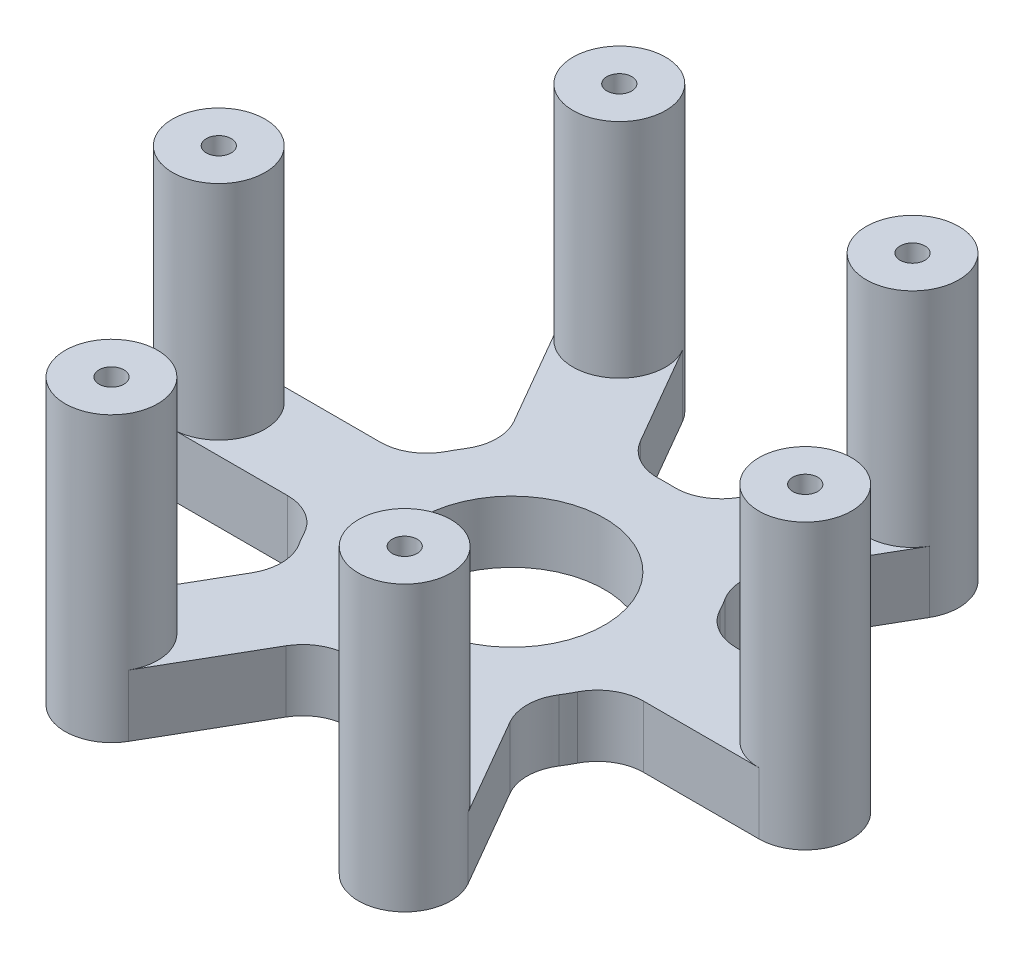
from build123d import *
from build123d.topology import SkipClean

# Parameters (mm, degrees)
SKETCH1_R                  = 25
SKETCH1_R_2                = 15
BOSS_EXTRUDE1_DEPTH        = 5
BOSS_EXTRUDE2_START        = -10
BOSS_EXTRUDE2_DEPTH        = 10
BOSS_EXTRUDE4_START        = 36
SKETCH8_R                  = 7.5
BOSS_EXTRUDE4_DEPTH        = 36
TAP_DRILL_FOR_10_32_TAP1_D = 4.0386
CIRPATTERN2_COUNT          = 6
FILLET1_R                  = 7.5


with BuildPart() as part:
    # Sketch1 → Boss-Extrude1 (new, symmetric)
    with BuildSketch(Plane(origin=(0, 0, 0), x_dir=(1, 0, 0), z_dir=(0, 1, 0))):
        with Locations(Location((0, 0, 0), (0, 0, 270))):
            Circle(SKETCH1_R)
        with Locations(Location((0, 0, 0), (0, 0, 270))):
            Circle(SKETCH1_R_2, mode=Mode.SUBTRACT)
    boss_extrude1 = extrude(amount=BOSS_EXTRUDE1_DEPTH, both=True)

    # Sketch2 → Boss-Extrude2 (add)
    with BuildSketch(Plane.XZ.offset(5).offset(BOSS_EXTRUDE2_START)):
        with BuildLine():
            ThreePointArc((55, 0), (52.803300859, 5.303300859), (47.5, 7.5))
            Line((47.5, 7.5), (23.848480035, 7.5))
            ThreePointArc((23.848480035, 7.5), (24.710443145, 3.793942482), (25, 0))
            ThreePointArc((25, 0), (24.710443145, -3.793942482), (23.848480035, -7.5))
            Line((23.848480035, -7.5), (47.5, -7.5))
            ThreePointArc((47.5, -7.5), (52.803300859, -5.303300859), (55, 0))
        make_face()
    boss_extrude2 = extrude(amount=BOSS_EXTRUDE2_DEPTH)

    # Sketch8 → Boss-Extrude4 (add)
    with SkipClean():  # the faces are left unmerged after this step: merging them gives an invalid solid
        with BuildSketch(Plane(origin=(0, 5, 0), x_dir=(1, 0, 0), z_dir=(0, 1, 0)).offset(BOSS_EXTRUDE4_START)):
            with Locations(Location((47.5, 0, 0), (0, 0, 270))):
                Circle(SKETCH8_R)
        boss_extrude4 = extrude(amount=-BOSS_EXTRUDE4_DEPTH)

    # Tap Drill for #10-32 Tap1 (through all)
    with Locations(Plane(origin=(0, -5, 0), x_dir=(-1, 0, 0), z_dir=(0, -1, 0))):
        with Locations((-47.5, 0)):
            tap_drill_for_10_32_tap1 = Hole(TAP_DRILL_FOR_10_32_TAP1_D / 2)

    # CirPattern2: Boss-Extrude1, Boss-Extrude2, Boss-Extrude4, Tap Drill for #10-32 Tap1 ×6 about axis
    cirpattern2_axis = Axis((0, 0, 0), (0, 1, 0))
    add([boss_extrude1.rotate(cirpattern2_axis, i * 360 / CIRPATTERN2_COUNT) for i in range(1, CIRPATTERN2_COUNT)])
    add([boss_extrude2.rotate(cirpattern2_axis, i * 360 / CIRPATTERN2_COUNT) for i in range(1, CIRPATTERN2_COUNT)])
    add([boss_extrude4.rotate(cirpattern2_axis, i * 360 / CIRPATTERN2_COUNT) for i in range(1, CIRPATTERN2_COUNT)])
    add([tap_drill_for_10_32_tap1.rotate(cirpattern2_axis, i * 360 / CIRPATTERN2_COUNT) for i in range(1, CIRPATTERN2_COUNT)], mode=Mode.SUBTRACT)

    # Fillet1
    fillet1_edges = [part.edges().sort_by_distance(p)[0] for p in [
        (23.848480035, 0, -7.5),
        (23.848480035, 0, 7.5),
        (18.419430546, 0, 16.903389552),
        (5.429049489, 0, 24.403389552),
        (-5.429049489, 0, 24.403389552),
        (-18.419430546, 0, 16.903389552),
        (-23.848480035, 0, 7.5),
        (-23.848480035, 0, -7.5),
        (-18.419430546, 0, -16.903389552),
        (-5.429049489, 0, -24.403389552),
        (5.429049489, 0, -24.403389552),
        (18.419430546, 0, -16.903389552),
    ]]
    fillet(fillet1_edges, radius=FILLET1_R)


solid = part.part
